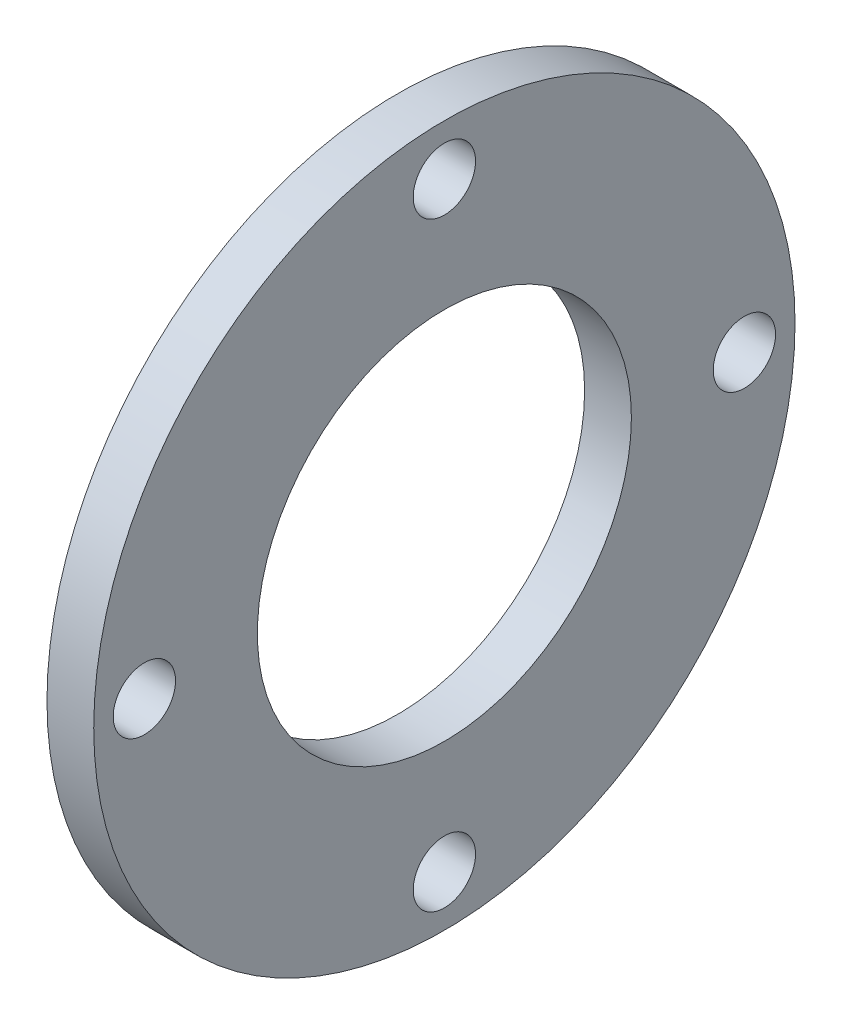
from build123d import *

# Parameters (mm, degrees)
SKETCH1_R           = 22.5
SKETCH1_R_2         = 12
SKETCH1_R_3         = 2
BOSS_EXTRUDE1_DEPTH = 3


with BuildPart() as part:
    # Sketch1 → Boss-Extrude1 (new body)
    with BuildSketch(Plane(origin=(0, 0, 0), x_dir=(0, 0, -1), z_dir=(1, 0, 0))):
        Circle(SKETCH1_R)
        Circle(SKETCH1_R_2, mode=Mode.SUBTRACT)
        with Locations((0, 19.25)):
            Circle(SKETCH1_R_3, mode=Mode.SUBTRACT)
        with Locations((19.25, 0)):
            Circle(SKETCH1_R_3, mode=Mode.SUBTRACT)
        with Locations((0, -19.25)):
            Circle(SKETCH1_R_3, mode=Mode.SUBTRACT)
        with Locations((-19.25, 0)):
            Circle(SKETCH1_R_3, mode=Mode.SUBTRACT)
    extrude(amount=BOSS_EXTRUDE1_DEPTH)


solid = part.part
